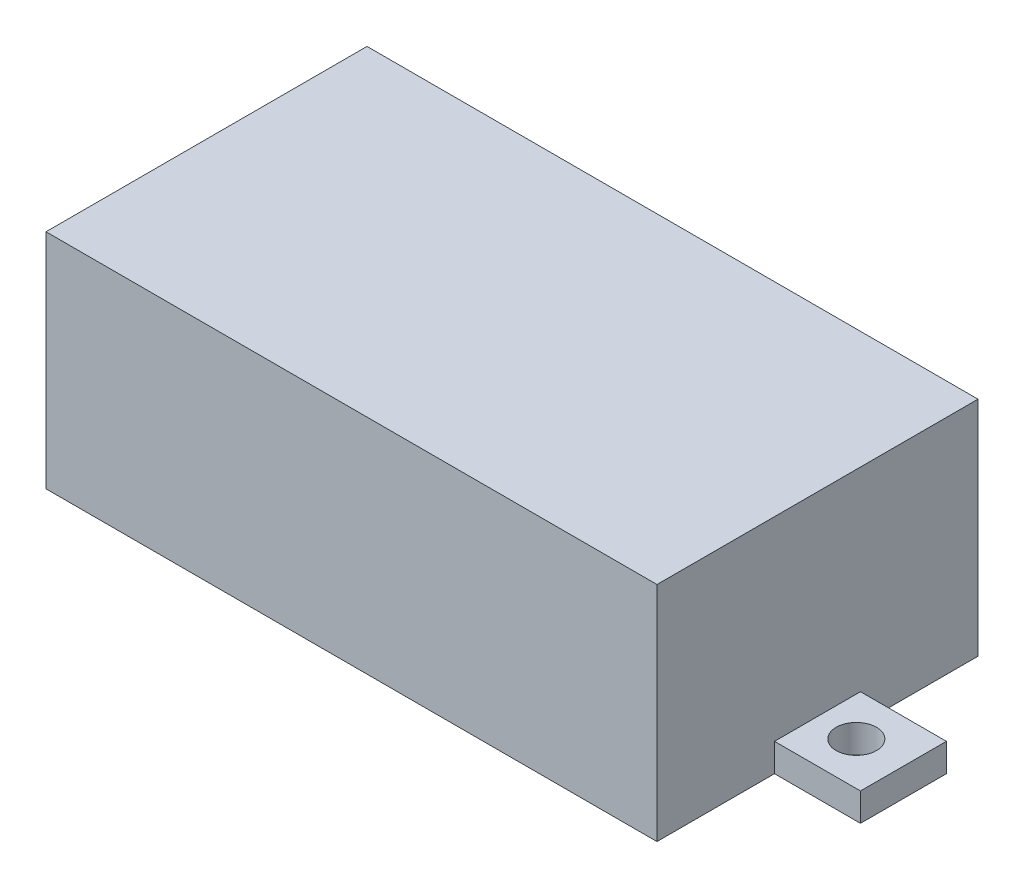
from build123d import *

# Parameters (mm, degrees)
SKETCH2_W           = 59
SKETCH2_H           = 31
BOSS_EXTRUDE1_DEPTH = 21.5
SKETCH3_W           = 8.3
SKETCH3_H           = 8.3
SKETCH3_R           = 1.95
BOSS_EXTRUDE2_DEPTH = 2.71


with BuildPart() as part:
    # Sketch2 → Boss-Extrude1 (new body)
    with BuildSketch(Plane(origin=(0, 0, 0), x_dir=(1, 0, 0), z_dir=(0, 1, 0))):
        Rectangle(SKETCH2_W, SKETCH2_H)
    extrude(amount=BOSS_EXTRUDE1_DEPTH)

    # Sketch3 → Boss-Extrude2 (add)
    # profile 1 of 2: a face of its own
    with BuildSketch(Plane.XZ):
        with Locations((-33.65, 0)):
            Rectangle(SKETCH3_W, SKETCH3_H)
        with Locations(Location((-33.25, 0, 0), (0, 0, 270))):
            Circle(SKETCH3_R, mode=Mode.SUBTRACT)
    # profile 2 of 2: a face of its own
    with BuildSketch(Plane.XZ):
        with Locations((33.65, 0)):
            Rectangle(SKETCH3_W, SKETCH3_H)
        with Locations(Location((33.25, 0, 0), (0, 0, 90))):
            Circle(SKETCH3_R, mode=Mode.SUBTRACT)
    extrude(amount=-BOSS_EXTRUDE2_DEPTH)


solid = part.part
